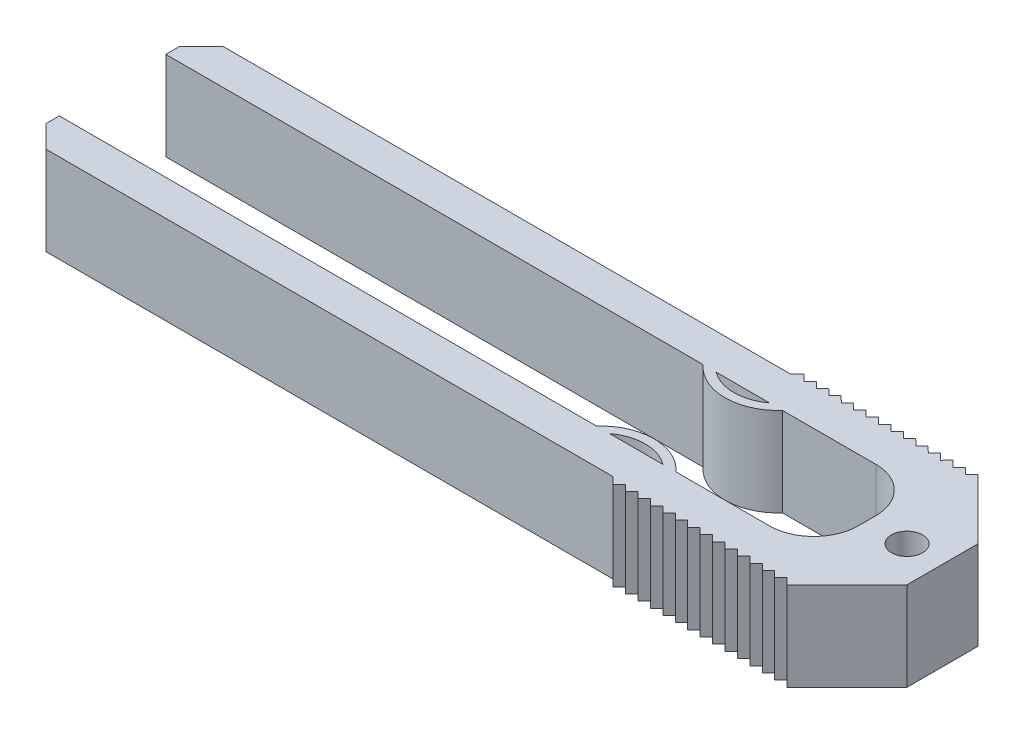
from build123d import *

# Parameters (mm, degrees)
BOSS_EXTRUDE1_DEPTH = 20
FILLET1_R           = 10
CHAMFER1_SIZE       = 5
CHAMFER2_SIZE       = 5
BOSS_EXTRUDE2_DEPTH = 20
BOSS_EXTRUDE3_DEPTH = 20
BOSS_EXTRUDE4_DEPTH = 20
BOSS_EXTRUDE5_DEPTH = 20
SKETCH6_R           = 3.5
CUT_EXTRUDE1_DEPTH  = 20


with BuildPart() as part:
    # Sketch1 → Boss-Extrude1 (new body)
    with BuildSketch(Plane(origin=(0, 0, 0), x_dir=(1, 0, 0), z_dir=(0, 1, 0))):
        Polygon((-90, -12), (-90, -20), (90, -20), (90, 20), (-90, 20), (-90, 12), (80, 12), (80, -12), align=None)
    extrude(amount=BOSS_EXTRUDE1_DEPTH)

    # Fillet1
    fillet1_edges = [part.edges().sort_by_distance(p)[0] for p in [
        (80, 10, 12),
        (80, 10, -12),
    ]]
    fillet(fillet1_edges, radius=FILLET1_R)

    # Chamfer1
    chamfer1_edges = [part.edges().sort_by_distance(p)[0] for p in [
        (90, 10, 20),
        (90, 10, -20),
    ]]
    chamfer(chamfer1_edges, length=CHAMFER1_SIZE)

    # Chamfer2
    chamfer2_edges = [part.edges().sort_by_distance(p)[0] for p in [
        (-90, 10, 20),
        (-90, 10, -20),
    ]]
    chamfer(chamfer2_edges, length=CHAMFER2_SIZE)

    # Sketch2 → Boss-Extrude2 (add)
    with BuildSketch(Plane(origin=(0, 20, 0), x_dir=(1, 0, 0), z_dir=(0, 1, 0))):
        with BuildLine():
            Line((31.05572809, -12), (34, -12))
            ThreePointArc((34, -12), (40, -10), (46, -12))
            Line((46, -12), (48.94427191, -12))
            ThreePointArc((48.94427191, -12), (40, -8), (31.05572809, -12))
        make_face()
        with BuildLine():
            Line((31.05572809, 12), (34, 12))
            ThreePointArc((34, 12), (40, 10), (46, 12))
            Line((46, 12), (48.94427191, 12))
            ThreePointArc((48.94427191, 12), (40, 8), (31.05572809, 12))
        make_face()
    extrude(amount=-BOSS_EXTRUDE2_DEPTH)

    # Sketch3 → Boss-Extrude3 (add)
    with BuildSketch(Plane(origin=(0, 20, 0), x_dir=(1, 0, 0), z_dir=(0, 1, 0))):
        Polygon((85, 20), (83.468895387, 21.5), (82.097625423, 20.100294822), (80.668895387, 21.5), (79.297625423, 20.100294822), (77.868895387, 21.5), (76.497625423, 20.100294822), (75.068895387, 21.5), (73.697625423, 20.100294822), (72.268895387, 21.5), (70.897625423, 20.100294822), (69.468895387, 21.5), (68.097625423, 20.100294822), (66.668895387, 21.5), (65.297625423, 20.100294822), (63.868895387, 21.5), (62.497625423, 20.100294822), (61.068895387, 21.5), (59.697625423, 20.100294822), (58.268895387, 21.5), (56.897625423, 20.100294822), (55.468895387, 21.5), (54.097625423, 20.100294822), (52.668895387, 21.5), (51.297625423, 20.100294822), (49.868895387, 21.5), (48.497625423, 20.100294822), (47.068895387, 21.5), (45.697625423, 20.100294822), (44.268895387, 21.5), (42.799368105, 20), align=None)
    extrude(amount=-BOSS_EXTRUDE3_DEPTH)

    # Sketch4 → Boss-Extrude4 (add)
    with BuildSketch(Plane(origin=(0, 20, 0), x_dir=(1, 0, 0), z_dir=(0, 1, 0))):
        Polygon((83.5, -21.5), (85, -20), (42.8, -20), (44.3, -21.5), (45.7, -20.1), (47.1, -21.5), (48.5, -20.1), (49.9, -21.5), (51.3, -20.1), (52.7, -21.5), (54.1, -20.1), (55.5, -21.5), (56.9, -20.1), (58.3, -21.5), (59.7, -20.1), (61.1, -21.5), (62.5, -20.1), (63.9, -21.5), (65.3, -20.1), (66.7, -21.5), (68.1, -20.1), (69.5, -21.5), (70.9, -20.1), (72.3, -21.5), (73.7, -20.1), (75.1, -21.5), (76.5, -20.1), (77.9, -21.5), (79.3, -20.1), (80.7, -21.5), (82.1, -20.1), align=None)
    extrude(amount=-BOSS_EXTRUDE4_DEPTH)

    # Sketch5 → Boss-Extrude5 (add)
    with BuildSketch(Plane(origin=(0, 20, 0), x_dir=(1, 0, 0), z_dir=(0, 1, 0))):
        Polygon((90, 15), (97, 8), (97, -8), (90, -15), align=None)
    extrude(amount=-BOSS_EXTRUDE5_DEPTH)

    # Sketch6 → Cut-Extrude1 (cut)
    with BuildSketch(Plane(origin=(0, 20, 0), x_dir=(1, 0, 0), z_dir=(0, 1, 0))):
        with Locations(Location((89, 0, 0), (0, 0, 270))):
            Circle(SKETCH6_R)
    extrude(amount=-CUT_EXTRUDE1_DEPTH, mode=Mode.SUBTRACT)


solid = part.part
